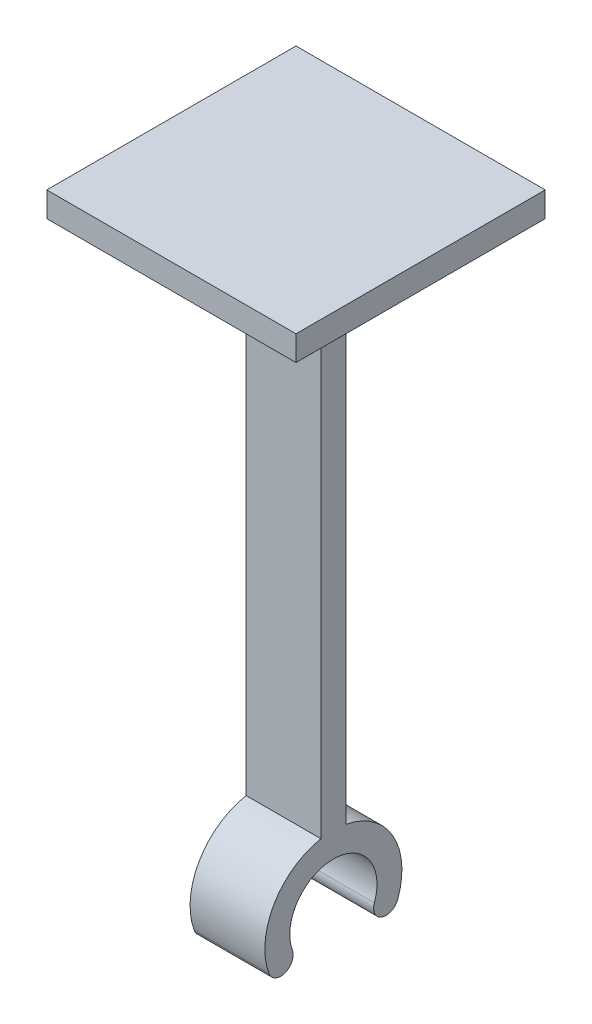
from build123d import *

# Parameters (mm, degrees)
BOSS_EXTRUDE1_DEPTH      = 3
BOSS_EXTRUDE1_DEPTH_BACK = 3
BOSS_EXTRUDE2_DEPTH      = 3
BOSS_EXTRUDE3_DEPTH      = 3
SKETCH4_W                = 20
SKETCH4_H                = 20
BOSS_EXTRUDE4_DEPTH      = 2


with BuildPart() as part:
    # Sketch1 → Boss-Extrude1 (new, two sides: drawn at the far end of the back side and taken through both)
    with BuildSketch(Plane(origin=(0, 0, 0), x_dir=(0, 0, -1), z_dir=(1, 0, 0)).offset(-BOSS_EXTRUDE1_DEPTH_BACK)):
        with BuildLine():
            ThreePointArc((-3.288924173, -1.197070502), (0, 3.5), (3.288924173, -1.197070502))
            ThreePointArc((3.288924173, -1.197070502), (3.88659665, -2.478783266), (5.168309414, -1.881110788))
            ThreePointArc((5.168309414, -1.881110788), (0, 5.5), (-5.168309414, -1.881110788))
            ThreePointArc((-5.168309414, -1.881110788), (-3.88659665, -2.478783266), (-3.288924173, -1.197070502))
        make_face()
    extrude(amount=BOSS_EXTRUDE1_DEPTH + BOSS_EXTRUDE1_DEPTH_BACK)

    # Sketch2 → Boss-Extrude2 (add)
    with BuildSketch(Plane(origin=(0, 0, 0), x_dir=(0, 0, -1), z_dir=(1, 0, 0))):
        Polygon((-1, 3.5), (0, 3.5), (1, 3.5), (1, 46.5), (-1, 46.5), align=None)
    extrude(amount=BOSS_EXTRUDE2_DEPTH)

    # Sketch3 → Boss-Extrude3 (add)
    with BuildSketch(Plane(origin=(0, 0, 0), x_dir=(0, 0, -1), z_dir=(1, 0, 0))):
        Polygon((1, 46.5), (0, 46.5), (-1, 46.5), (-1, 3.5), (1, 3.5), align=None)
    extrude(amount=-BOSS_EXTRUDE3_DEPTH)

    # Sketch4 → Boss-Extrude4 (add)
    with BuildSketch(Plane(origin=(0, 46.5, 0), x_dir=(1, 0, 0), z_dir=(0, 1, 0))):
        Rectangle(SKETCH4_W, SKETCH4_H)
    extrude(amount=BOSS_EXTRUDE4_DEPTH)


solid = part.part
